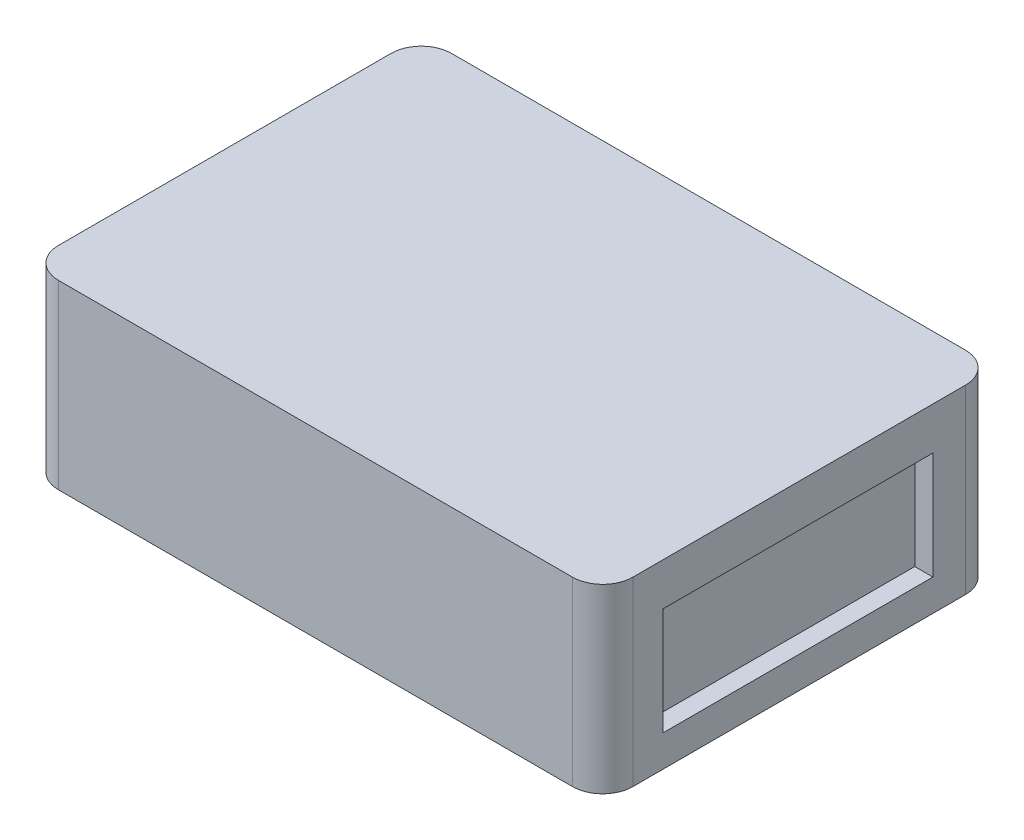
from build123d import *

# Parameters (mm, degrees)
SKETCH_2_W          = 95
SKETCH_2_H          = 65
EXTRUDE_1_DEPTH     = 30
FILLET_1_R          = 5
SKETCH_3_R          = 1.5
CUT_EXTRUDE_1_DEPTH = 10
SKETCH_4_W          = 44.622650634
SKETCH_4_H          = 17.76241433
CUT_EXTRUDE_2_DEPTH = 3


with BuildPart() as part:
    # 草图2 → 凸台-拉伸1 (new body)
    with BuildSketch(Plane(origin=(0, 0, 0), x_dir=(1, 0, 0), z_dir=(0, 1, 0))):
        Rectangle(SKETCH_2_W, SKETCH_2_H)
    extrude(amount=EXTRUDE_1_DEPTH)

    # 圆角1
    fillet_1_edges = [part.edges().sort_by_distance(p)[0] for p in [
        (47.5, 15, 32.5),
        (-47.5, 15, 32.5),
        (-47.5, 15, -32.5),
        (47.5, 15, -32.5),
    ]]
    fillet(fillet_1_edges, radius=FILLET_1_R)

    # 草图3 → 切除-拉伸1 (cut)
    with BuildSketch(Plane.XZ):
        with Locations(Location((-40.661720084, 23, 0), (0, 0, 270))):
            Circle(SKETCH_3_R)
        with Locations(Location((-40.661720084, -23, 0), (0, 0, 270))):
            Circle(SKETCH_3_R)
        with Locations(Location((14.338279916, 23, 0), (0, 0, 270))):
            Circle(SKETCH_3_R)
        with Locations(Location((14.338279916, -23, 0), (0, 0, 270))):
            Circle(SKETCH_3_R)
    extrude(amount=-CUT_EXTRUDE_1_DEPTH, mode=Mode.SUBTRACT)

    # 草图4 → 切除-拉伸2 (cut)
    with BuildSketch(Plane(origin=(47.5, 0, 0), x_dir=(0, 0, -1), z_dir=(1, 0, 0))):
        with Locations((-0.211139555, 14.091574869)):
            Rectangle(SKETCH_4_W, SKETCH_4_H)
    extrude(amount=-CUT_EXTRUDE_2_DEPTH, mode=Mode.SUBTRACT)


solid = part.part
